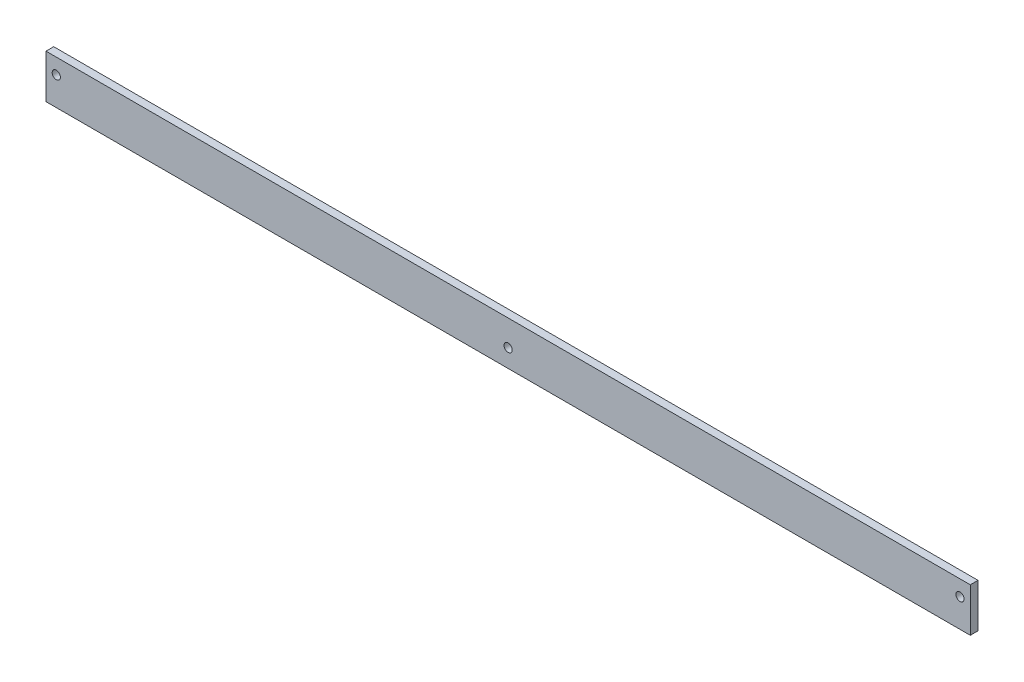
from build123d import *

# Parameters (mm, degrees)
ESQUISSE1_W        = 359
ESQUISSE1_H        = 17
BOSS_EXTRU_1_DEPTH = 3
SKETCH1_R          = 1.6
CUT_EXTRUDE1_DEPTH = 260.656503866
SKETCH2_R          = 1.6
CUT_EXTRUDE2_DEPTH = 260.656503866
SKETCH3_R          = 1.6
CUT_EXTRUDE3_DEPTH = 260.656503866


with BuildPart() as part:
    # Esquisse1 → Boss.-Extru.1 (new body)
    with BuildSketch(Plane.XY):
        with Locations((80, 0)):
            Rectangle(ESQUISSE1_W, ESQUISSE1_H)
    extrude(amount=BOSS_EXTRU_1_DEPTH)

    # Sketch1 → Cut-Extrude1 (cut, through all)
    with BuildSketch(Plane(origin=(0, 0, 0), x_dir=(-1, 0, 0), z_dir=(0, 0, -1))):
        with Locations((95.5, 2.5)):
            Circle(SKETCH1_R)
    extrude(amount=-CUT_EXTRUDE1_DEPTH, mode=Mode.SUBTRACT)

    # Sketch2 → Cut-Extrude2 (cut, through all)
    with BuildSketch(Plane(origin=(0, 0, 0), x_dir=(-1, 0, 0), z_dir=(0, 0, -1))):
        with Locations((-255.5, 2.5)):
            Circle(SKETCH2_R)
    extrude(amount=-CUT_EXTRUDE2_DEPTH, mode=Mode.SUBTRACT)

    # Sketch3 → Cut-Extrude3 (cut, through all)
    with BuildSketch(Plane(origin=(0, 0, 0), x_dir=(-1, 0, 0), z_dir=(0, 0, -1))):
        with Locations((-80, -1.5)):
            Circle(SKETCH3_R)
    extrude(amount=-CUT_EXTRUDE3_DEPTH, mode=Mode.SUBTRACT)


solid = part.part
